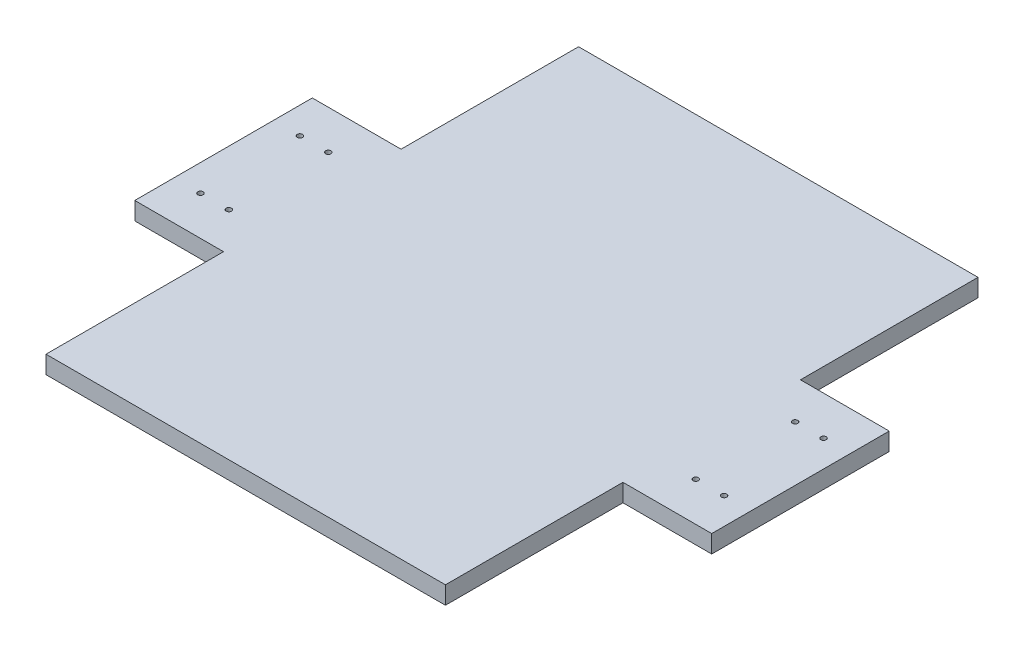
from build123d import *

# Parameters (mm, degrees)
BOSS_EXTRUDE1_DEPTH = 20
CUT_EXTRUDE1_REACH  = 444.747
SKETCH2_R           = 3


with BuildPart() as part:
    # Sketch1 → Boss-Extrude1 (new body)
    with BuildSketch(Plane(origin=(0, 0, 0), x_dir=(1, 0, 0), z_dir=(0, 1, 0))):
        Polygon((-225, -300), (225, -300), (225, -100), (325, -100), (325, 100), (225, 100), (225, 300), (-225, 300), (-225, 100), (-325, 100), (-325, -100), (-225, -100), align=None)
    extrude(amount=BOSS_EXTRUDE1_DEPTH)

    # Sketch2 → Cut-Extrude1 (cut, up to next)
    with BuildSketch(Plane(origin=(0, 20, 0), x_dir=(1, 0, 0), z_dir=(0, 1, 0)), mode=Mode.PRIVATE) as cut_extrude1_sk1:
        with Locations(Location((-295, -56, 0), (0, 0, 270))):
            Circle(SKETCH2_R)
    cut_extrude1_tool1 = extrude(cut_extrude1_sk1.sketch, amount=-CUT_EXTRUDE1_REACH, mode=Mode.PRIVATE) & part.part
    # Sketch2 → Cut-Extrude1 (cut, up to next)
    with BuildSketch(Plane(origin=(0, 20, 0), x_dir=(1, 0, 0), z_dir=(0, 1, 0)), mode=Mode.PRIVATE) as cut_extrude1_sk2:
        with Locations(Location((-263, -56, 0), (0, 0, 270))):
            Circle(SKETCH2_R)
    cut_extrude1_tool2 = extrude(cut_extrude1_sk2.sketch, amount=-CUT_EXTRUDE1_REACH, mode=Mode.PRIVATE) & part.part
    # Sketch2 → Cut-Extrude1 (cut, up to next)
    with BuildSketch(Plane(origin=(0, 20, 0), x_dir=(1, 0, 0), z_dir=(0, 1, 0)), mode=Mode.PRIVATE) as cut_extrude1_sk3:
        with Locations(Location((-263, 56, 0), (0, 0, 270))):
            Circle(SKETCH2_R)
    cut_extrude1_tool3 = extrude(cut_extrude1_sk3.sketch, amount=-CUT_EXTRUDE1_REACH, mode=Mode.PRIVATE) & part.part
    # Sketch2 → Cut-Extrude1 (cut, up to next)
    with BuildSketch(Plane(origin=(0, 20, 0), x_dir=(1, 0, 0), z_dir=(0, 1, 0)), mode=Mode.PRIVATE) as cut_extrude1_sk4:
        with Locations(Location((-295, 56, 0), (0, 0, 270))):
            Circle(SKETCH2_R)
    cut_extrude1_tool4 = extrude(cut_extrude1_sk4.sketch, amount=-CUT_EXTRUDE1_REACH, mode=Mode.PRIVATE) & part.part
    cut_extrude1_1 = cut_extrude1_tool1.solids().sort_by_distance((-295, 20, 56))[0]
    add(cut_extrude1_1, mode=Mode.SUBTRACT)
    cut_extrude1_2 = cut_extrude1_tool2.solids().sort_by_distance((-263, 20, 56))[0]
    add(cut_extrude1_2, mode=Mode.SUBTRACT)
    cut_extrude1_3 = cut_extrude1_tool3.solids().sort_by_distance((-263, 20, -56))[0]
    add(cut_extrude1_3, mode=Mode.SUBTRACT)
    cut_extrude1_4 = cut_extrude1_tool4.solids().sort_by_distance((-295, 20, -56))[0]
    add(cut_extrude1_4, mode=Mode.SUBTRACT)
    cut_extrude1 = cut_extrude1_1 + cut_extrude1_2 + cut_extrude1_3 + cut_extrude1_4  # Cut-Extrude1 as one shape, for the pattern or mirror that repeats it

    # Mirror1: Cut-Extrude1 across plane
    add(cut_extrude1.mirror(Plane(origin=(0, 0, 0), x_dir=(0, 0, 1), z_dir=(1, 0, 0))), mode=Mode.SUBTRACT)


solid = part.part
